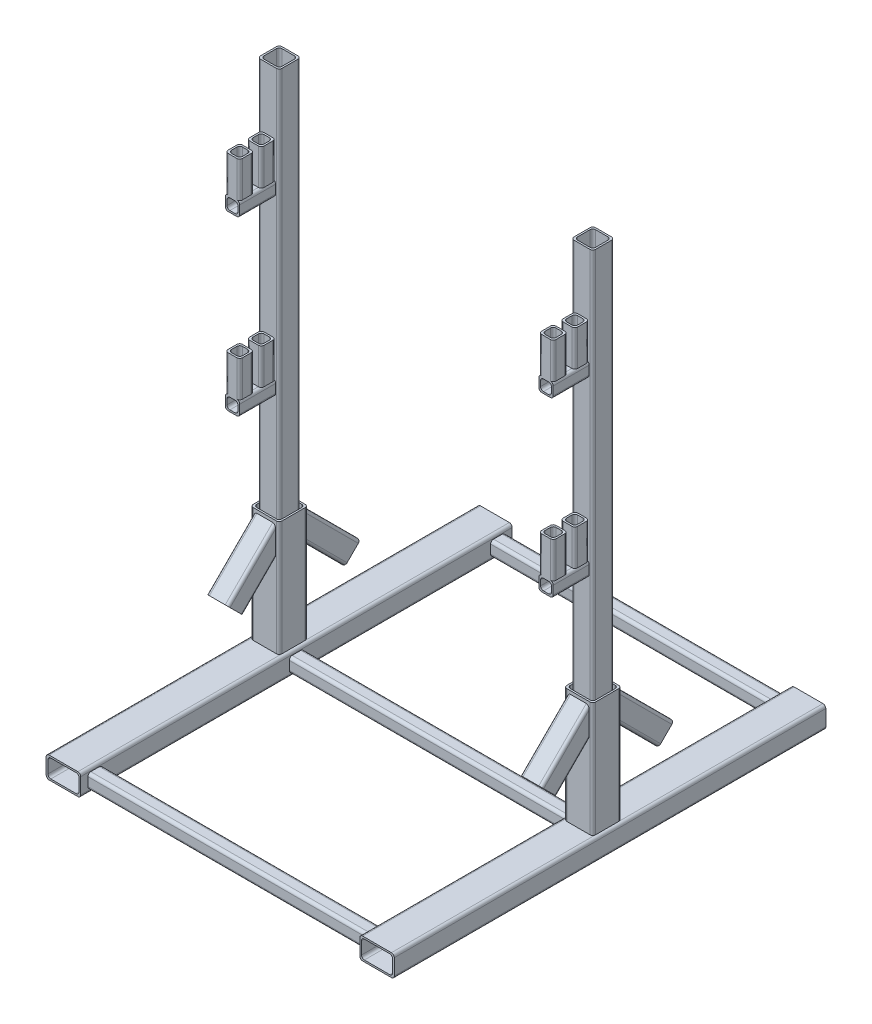
from build123d import *

# Parameters (mm, degrees)
BOSS_EXTRUDE1_DEPTH = 1750
BOSS_EXTRUDE2_DEPTH = 125
BOSS_EXTRUDE3_DEPTH = 125
LPATTERN1_COUNT     = 2
LPATTERN1_PITCH     = 600
BOSS_EXTRUDE4_DEPTH = 400
BOSS_EXTRUDE5_DEPTH = 750
BOSS_EXTRUDE7_DEPTH = 485
BOSS_EXTRUDE8_REACH = 1975.463
BOSS_EXTRUDE9_REACH = 1985.717
LPATTERN2_COUNT     = 3
LPATTERN2_PITCH     = 700


with BuildPart() as part:
    # Sketch2 → Boss-Extrude1 (new body)
    with BuildSketch(Plane(origin=(0, 0, 0), x_dir=(1, 0, 0), z_dir=(0, 1, 0))):
        with BuildLine():
            Line((-565, 37.5), (-510, 37.5))
            ThreePointArc((-510, 37.5), (-502.928932188, 34.571067812), (-500, 27.5))
            Line((-500, 27.5), (-500, -27.5))
            ThreePointArc((-500, -27.5), (-502.928932188, -34.571067812), (-510, -37.5))
            Line((-510, -37.5), (-565, -37.5))
            ThreePointArc((-565, -37.5), (-572.071067812, -34.571067812), (-575, -27.5))
            Line((-575, -27.5), (-575, 27.5))
            ThreePointArc((-575, 27.5), (-572.071067812, 34.571067812), (-565, 37.5))
        make_face()
        with BuildLine():
            Line((-559, 31.5), (-516, 31.5))
            ThreePointArc((-516, 31.5), (-508.928932188, 28.571067812), (-506, 21.5))
            Line((-506, 21.5), (-506, -21.5))
            ThreePointArc((-506, -21.5), (-508.928932188, -28.571067812), (-516, -31.5))
            Line((-516, -31.5), (-559, -31.5))
            ThreePointArc((-559, -31.5), (-566.071067812, -28.571067812), (-569, -21.5))
            Line((-569, -21.5), (-569, 21.5))
            ThreePointArc((-569, 21.5), (-566.071067812, 28.571067812), (-559, 31.5))
        make_face(mode=Mode.SUBTRACT)
    extrude(amount=-BOSS_EXTRUDE1_DEPTH)

    # Sketch3 → Boss-Extrude2 (add)
    with BuildSketch(Plane.XY.offset(37.5)):
        with BuildLine():
            Line((-552.5, -340), (-522.5, -340))
            ThreePointArc((-522.5, -340), (-515.428932188, -342.928932188), (-512.5, -350))
            Line((-512.5, -350), (-512.5, -380))
            ThreePointArc((-512.5, -380), (-515.428932188, -387.071067812), (-522.5, -390))
            Line((-522.5, -390), (-552.5, -390))
            ThreePointArc((-552.5, -390), (-559.571067812, -387.071067812), (-562.5, -380))
            Line((-562.5, -380), (-562.5, -350))
            ThreePointArc((-562.5, -350), (-559.571067812, -342.928932188), (-552.5, -340))
        make_face()
        with BuildLine():
            Line((-546.5, -346), (-528.5, -346))
            ThreePointArc((-528.5, -346), (-521.428932188, -348.928932188), (-518.5, -356))
            Line((-518.5, -356), (-518.5, -374))
            ThreePointArc((-518.5, -374), (-521.428932188, -381.071067812), (-528.5, -384))
            Line((-528.5, -384), (-546.5, -384))
            ThreePointArc((-546.5, -384), (-553.571067812, -381.071067812), (-556.5, -374))
            Line((-556.5, -374), (-556.5, -356))
            ThreePointArc((-556.5, -356), (-553.571067812, -348.928932188), (-546.5, -346))
        make_face(mode=Mode.SUBTRACT)
    boss_extrude2 = extrude(amount=BOSS_EXTRUDE2_DEPTH)

    # Sketch4 → Boss-Extrude3 (add)
    # profile 1 of 2: a face of its own
    with BuildSketch(Plane(origin=(0, -340, 0), x_dir=(1, 0, 0), z_dir=(0, 1, 0))):
        with BuildLine():
            Line((-552.5, -37.5), (-522.5, -37.5))
            ThreePointArc((-522.5, -37.5), (-515.428932188, -40.428932188), (-512.5, -47.5))
            Line((-512.5, -47.5), (-512.5, -77.5))
            ThreePointArc((-512.5, -77.5), (-515.428932188, -84.571067812), (-522.5, -87.5))
            Line((-522.5, -87.5), (-552.5, -87.5))
            ThreePointArc((-552.5, -87.5), (-559.571067812, -84.571067812), (-562.5, -77.5))
            Line((-562.5, -77.5), (-562.5, -47.5))
            ThreePointArc((-562.5, -47.5), (-559.571067812, -40.428932188), (-552.5, -37.5))
        make_face()
        with BuildLine():
            Line((-546.5, -43.5), (-528.5, -43.5))
            ThreePointArc((-528.5, -43.5), (-521.428932188, -46.428932188), (-518.5, -53.5))
            Line((-518.5, -53.5), (-518.5, -71.5))
            ThreePointArc((-518.5, -71.5), (-521.428932188, -78.571067812), (-528.5, -81.5))
            Line((-528.5, -81.5), (-546.5, -81.5))
            ThreePointArc((-546.5, -81.5), (-553.571067812, -78.571067812), (-556.5, -71.5))
            Line((-556.5, -71.5), (-556.5, -53.5))
            ThreePointArc((-556.5, -53.5), (-553.571067812, -46.428932188), (-546.5, -43.5))
        make_face(mode=Mode.SUBTRACT)
    # profile 2 of 2: a face of its own
    with BuildSketch(Plane(origin=(0, -340, 0), x_dir=(1, 0, 0), z_dir=(0, 1, 0))):
        with BuildLine():
            Line((-552.5, -112.5), (-522.5, -112.5))
            ThreePointArc((-522.5, -112.5), (-515.428932188, -115.428932188), (-512.5, -122.5))
            Line((-512.5, -122.5), (-512.5, -152.5))
            ThreePointArc((-512.5, -152.5), (-515.428932188, -159.571067812), (-522.5, -162.5))
            Line((-522.5, -162.5), (-552.5, -162.5))
            ThreePointArc((-552.5, -162.5), (-559.571067812, -159.571067812), (-562.5, -152.5))
            Line((-562.5, -152.5), (-562.5, -122.5))
            ThreePointArc((-562.5, -122.5), (-559.571067812, -115.428932188), (-552.5, -112.5))
        make_face()
        with BuildLine():
            Line((-546.5, -118.5), (-528.5, -118.5))
            ThreePointArc((-528.5, -118.5), (-521.428932188, -121.428932188), (-518.5, -128.5))
            Line((-518.5, -128.5), (-518.5, -146.5))
            ThreePointArc((-518.5, -146.5), (-521.428932188, -153.571067812), (-528.5, -156.5))
            Line((-528.5, -156.5), (-546.5, -156.5))
            ThreePointArc((-546.5, -156.5), (-553.571067812, -153.571067812), (-556.5, -146.5))
            Line((-556.5, -146.5), (-556.5, -128.5))
            ThreePointArc((-556.5, -128.5), (-553.571067812, -121.428932188), (-546.5, -118.5))
        make_face(mode=Mode.SUBTRACT)
    boss_extrude3 = extrude(amount=BOSS_EXTRUDE3_DEPTH)

    # LPattern1: Boss-Extrude2, Boss-Extrude3 ×2
    with Locations(*[(0, -i * LPATTERN1_PITCH, 0) for i in range(1, LPATTERN1_COUNT)]):
        add(boss_extrude2)
        add(boss_extrude3)



with BuildPart() as body_2:
    # Sketch5 → Boss-Extrude4 (new body)
    with BuildSketch(Plane.XZ.offset(1750)):
        with BuildLine():
            Line((-577.5, 50), (-497.5, 50))
            ThreePointArc((-497.5, 50), (-490.428932188, 47.071067812), (-487.5, 40))
            Line((-487.5, 40), (-487.5, -40))
            ThreePointArc((-487.5, -40), (-490.428932188, -47.071067812), (-497.5, -50))
            Line((-497.5, -50), (-577.5, -50))
            ThreePointArc((-577.5, -50), (-584.571067812, -47.071067812), (-587.5, -40))
            Line((-587.5, -40), (-587.5, 40))
            ThreePointArc((-587.5, 40), (-584.571067812, 47.071067812), (-577.5, 50))
        make_face()
        with BuildLine():
            Line((-571.5, 44), (-503.5, 44))
            ThreePointArc((-503.5, 44), (-496.428932188, 41.071067812), (-493.5, 34))
            Line((-493.5, 34), (-493.5, -34))
            ThreePointArc((-493.5, -34), (-496.428932188, -41.071067812), (-503.5, -44))
            Line((-503.5, -44), (-571.5, -44))
            ThreePointArc((-571.5, -44), (-578.571067812, -41.071067812), (-581.5, -34))
            Line((-581.5, -34), (-581.5, 34))
            ThreePointArc((-581.5, 34), (-578.571067812, 41.071067812), (-571.5, 44))
        make_face(mode=Mode.SUBTRACT)
    extrude(amount=-BOSS_EXTRUDE4_DEPTH)


with BuildPart() as part_1:
    add(part.part)

    add(body_2.part)  # Boss-Extrude5 merges body 2
    # Sketch6 → Boss-Extrude5 (add)
    with BuildSketch(Plane.XY):
        with BuildLine():
            Line((-587.5, -1750), (-487.5, -1750))
            ThreePointArc((-487.5, -1750), (-480.428932188, -1752.928932188), (-477.5, -1760))
            Line((-477.5, -1760), (-477.5, -1815))
            ThreePointArc((-477.5, -1815), (-480.428932188, -1822.071067812), (-487.5, -1825))
            Line((-487.5, -1825), (-587.5, -1825))
            ThreePointArc((-587.5, -1825), (-594.571067812, -1822.071067812), (-597.5, -1815))
            Line((-597.5, -1815), (-597.5, -1760))
            ThreePointArc((-597.5, -1760), (-594.571067812, -1752.928932188), (-587.5, -1750))
        make_face()
        with BuildLine():
            Line((-581.5, -1756), (-493.5, -1756))
            ThreePointArc((-493.5, -1756), (-486.428932188, -1758.928932188), (-483.5, -1766))
            Line((-483.5, -1766), (-483.5, -1809))
            ThreePointArc((-483.5, -1809), (-486.428932188, -1816.071067812), (-493.5, -1819))
            Line((-493.5, -1819), (-581.5, -1819))
            ThreePointArc((-581.5, -1819), (-588.571067812, -1816.071067812), (-591.5, -1809))
            Line((-591.5, -1809), (-591.5, -1766))
            ThreePointArc((-591.5, -1766), (-588.571067812, -1758.928932188), (-581.5, -1756))
        make_face(mode=Mode.SUBTRACT)
    boss_extrude5 = extrude(amount=BOSS_EXTRUDE5_DEPTH)

    # Mirror1: Boss-Extrude5 across plane
    add(boss_extrude5.mirror(Plane.XY))

    # Sketch10 → Boss-Extrude7 (add)
    with BuildSketch(Plane(origin=(-477.5, 0, 0), x_dir=(0, 0, -1), z_dir=(1, 0, 0))):
        with BuildLine():
            Line((-715, -1762.5), (-685, -1762.5))
            ThreePointArc((-685, -1762.5), (-677.928932188, -1765.428932188), (-675, -1772.5))
            Line((-675, -1772.5), (-675, -1802.5))
            ThreePointArc((-675, -1802.5), (-677.928932188, -1809.571067812), (-685, -1812.5))
            Line((-685, -1812.5), (-715, -1812.5))
            ThreePointArc((-715, -1812.5), (-722.071067812, -1809.571067812), (-725, -1802.5))
            Line((-725, -1802.5), (-725, -1772.5))
            ThreePointArc((-725, -1772.5), (-722.071067812, -1765.428932188), (-715, -1762.5))
        make_face()
        with BuildLine():
            Line((-709, -1768.5), (-691, -1768.5))
            ThreePointArc((-691, -1768.5), (-683.928932188, -1771.428932188), (-681, -1778.5))
            Line((-681, -1778.5), (-681, -1796.5))
            ThreePointArc((-681, -1796.5), (-683.928932188, -1803.571067812), (-691, -1806.5))
            Line((-691, -1806.5), (-709, -1806.5))
            ThreePointArc((-709, -1806.5), (-716.071067812, -1803.571067812), (-719, -1796.5))
            Line((-719, -1796.5), (-719, -1778.5))
            ThreePointArc((-719, -1778.5), (-716.071067812, -1771.428932188), (-709, -1768.5))
        make_face(mode=Mode.SUBTRACT)
    boss_extrude7 = extrude(amount=BOSS_EXTRUDE7_DEPTH)

    # Boss-Extrude8: up to this plane
    boss_extrude8_end = Plane(origin=(-577.5, -1350, 50), z_dir=(0, 0, 1))
    # Sketch9 → Boss-Extrude8 (add, up to the surface)
    with BuildSketch(Plane(origin=(0, -870.844874443, 870.844874443), x_dir=(0, 0.707106781186549, 0.7071067811865461), z_dir=(0, 0.7071067811865461, -0.707106781186549)), mode=Mode.PRIVATE) as boss_extrude8_sk1:
        with BuildLine():
            Line((-937.081528017, -575), (-992.081528017, -575))
            ThreePointArc((-992.081528017, -575), (-999.152595829, -572.071067812), (-1002.081528017, -565))
            Line((-1002.081528017, -565), (-1002.081528017, -510))
            ThreePointArc((-1002.081528017, -510), (-999.152595829, -502.928932188), (-992.081528017, -500))
            Line((-992.081528017, -500), (-937.081528017, -500))
            ThreePointArc((-937.081528017, -500), (-930.010460205, -502.928932188), (-927.081528017, -510))
            Line((-927.081528017, -510), (-927.081528017, -565))
            ThreePointArc((-927.081528017, -565), (-930.010460205, -572.071067812), (-937.081528017, -575))
        make_face()
        with BuildLine():
            Line((-943.081528017, -569), (-986.081528017, -569))
            ThreePointArc((-986.081528017, -569), (-993.152595829, -566.071067812), (-996.081528017, -559))
            Line((-996.081528017, -559), (-996.081528017, -516))
            ThreePointArc((-996.081528017, -516), (-993.152595829, -508.928932188), (-986.081528017, -506))
            Line((-986.081528017, -506), (-943.081528017, -506))
            ThreePointArc((-943.081528017, -506), (-936.010460205, -508.928932188), (-933.081528017, -516))
            Line((-933.081528017, -516), (-933.081528017, -559))
            ThreePointArc((-933.081528017, -559), (-936.010460205, -566.071067812), (-943.081528017, -569))
        make_face(mode=Mode.SUBTRACT)
    boss_extrude8_tool1 = split(extrude(boss_extrude8_sk1.sketch, amount=BOSS_EXTRUDE8_REACH, mode=Mode.PRIVATE), bisect_by=boss_extrude8_end, keep=Keep.BOTH, mode=Mode.PRIVATE)
    add(boss_extrude8_tool1.solids().sort_by_distance((-571.321068, -1528.991908, 212.697841))[0])

    # Boss-Extrude9: up to this plane
    boss_extrude9_end = Plane(origin=(-577.5, -1350, -50), z_dir=(0, 0, -1))
    # Sketch12 → Boss-Extrude9 (add, up to the surface)
    with BuildSketch(Plane(origin=(0, -900, -900), x_dir=(1, 0, 0), z_dir=(0, 0.707106781186549, 0.7071067811865461)), mode=Mode.PRIVATE) as boss_extrude9_sk1:
        with BuildLine():
            Line((-510, -1002.081528017), (-565, -1002.081528017))
            ThreePointArc((-565, -1002.081528017), (-572.071067812, -999.152595829), (-575, -992.081528017))
            Line((-575, -992.081528017), (-575, -937.081528017))
            ThreePointArc((-575, -937.081528017), (-572.071067812, -930.010460205), (-565, -927.081528017))
            Line((-565, -927.081528017), (-510, -927.081528017))
            ThreePointArc((-510, -927.081528017), (-502.928932188, -930.010460205), (-500, -937.081528017))
            Line((-500, -937.081528017), (-500, -992.081528017))
            ThreePointArc((-500, -992.081528017), (-502.928932188, -999.152595829), (-510, -1002.081528017))
        make_face()
        with BuildLine():
            Line((-516, -996.081528017), (-559, -996.081528017))
            ThreePointArc((-559, -996.081528017), (-566.071067812, -993.152595829), (-569, -986.081528017))
            Line((-569, -986.081528017), (-569, -943.081528017))
            ThreePointArc((-569, -943.081528017), (-566.071067812, -936.010460205), (-559, -933.081528017))
            Line((-559, -933.081528017), (-516, -933.081528017))
            ThreePointArc((-516, -933.081528017), (-508.928932188, -936.010460205), (-506, -943.081528017))
            Line((-506, -943.081528017), (-506, -986.081528017))
            ThreePointArc((-506, -986.081528017), (-508.928932188, -993.152595829), (-516, -996.081528017))
        make_face(mode=Mode.SUBTRACT)
    boss_extrude9_tool1 = split(extrude(boss_extrude9_sk1.sketch, amount=BOSS_EXTRUDE9_REACH, mode=Mode.PRIVATE), bisect_by=boss_extrude9_end, keep=Keep.BOTH, mode=Mode.PRIVATE)
    add(boss_extrude9_tool1.solids().sort_by_distance((-501.06066, -1582.062139, -217.937861))[0])

    # LPattern2: Boss-Extrude7 ×3
    with Locations(*[(0, 0, -i * LPATTERN2_PITCH) for i in range(1, LPATTERN2_COUNT)]):
        add(boss_extrude7)

    # Mirror5: part across plane


with BuildPart() as part_2:
    add(part_1.part)
    add(part_1.part.mirror(Plane(origin=(7.5, -1772.5, 685), x_dir=(0, 0, 1), z_dir=(-1, 0, 0))))


solid = part_2.part
